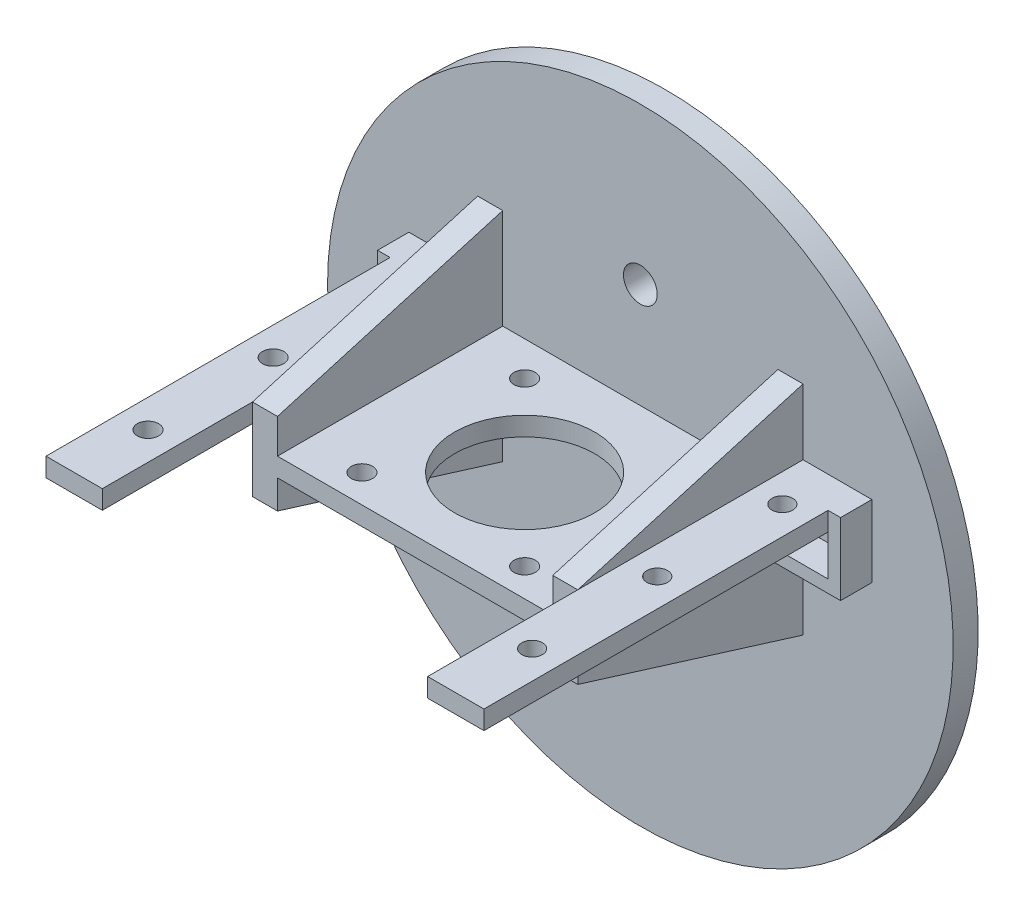
from build123d import *

# Parameters (mm, degrees)
SKETCH_1_W          = 70
SKETCH_1_H          = 58
EXTRUDE_1_DEPTH     = 4
SKETCH_2_W          = 9
SKETCH_2_H          = 3
EXTRUDE_2_DEPTH     = 60
SKETCH_4_W          = 70
SKETCH_4_H          = 4
EXTRUDE_4_DEPTH     = 9.5
EXTRUDE_START       = -9
EXTRUDE_5_DEPTH     = 4
SKETCH_5_R          = 50
EXTRUDE_6_DEPTH     = 4
SKETCH_6_R          = 32.5
EXTRUDE_7_DEPTH     = 6
SKETCH_7_R          = 20
CUT_EXTRUDE_1_DEPTH = 6
SKETCH_8_R          = 2.7
CUT_EXTRUDE_2_DEPTH = 10
SKETCH_9_R          = 2.7
CUT_EXTRUDE_3_DEPTH = 10
SKETCH_11_R         = 11.2
SKETCH_11_R_2       = 1.7
EXTRUDE_8_DEPTH     = 3
SKETCH_13_R         = 1.65
SKETCH_13_R_2       = 1.7
CUT_EXTRUDE_4_DEPTH = 10
EXTRUDE_9_DEPTH     = 5


with BuildPart() as part:
    # 草图1 → 凸台-拉伸1 (new body)
    with BuildSketch(Plane.XY):
        Rectangle(SKETCH_1_W, SKETCH_1_H)
    extrude(amount=EXTRUDE_1_DEPTH)

    # 草图2 → 凸台-拉伸2 (add)
    with BuildSketch(Plane.XY.offset(4)):
        with Locations((-30.5, 17)):
            Rectangle(SKETCH_2_W, SKETCH_2_H)
        with Locations((30.5, 17)):
            Rectangle(SKETCH_2_W, SKETCH_2_H)
    extrude(amount=EXTRUDE_2_DEPTH)

    # 草图4 → 凸台-拉伸4 (add)
    with BuildSketch(Plane(origin=(0, 29, 0), x_dir=(1, 0, 0), z_dir=(0, 1, 0))):
        with Locations((0, -2)):
            Rectangle(SKETCH_4_W, SKETCH_4_H)
    extrude(amount=EXTRUDE_4_DEPTH)

    # 草图3 → 凸台-拉伸5 (add)
    with BuildSketch(Plane(origin=(35, 0, 0), x_dir=(0, 0, -1), z_dir=(1, 0, 0)).offset(EXTRUDE_START)):
        Polygon((-4, 29), (-40, 18.5), (-40, 15.5), (-40, 5.399002441), (-4, -5.764089994), (-4, -29), (0, -29), (0, 29), align=None)
    extrude_5 = extrude(amount=-EXTRUDE_5_DEPTH)

    # 镜向2: 凸台-拉伸5 across plane
    add(extrude_5.mirror(Plane(origin=(0, 0, 0), x_dir=(0, 0, 1), z_dir=(1, 0, 0))))

    # 草图5 → 凸台-拉伸6 (add)
    with BuildSketch(Plane(origin=(0, 0, 0), x_dir=(-1, 0, 0), z_dir=(0, 0, -1))):
        with Locations((0, 4.75)):
            Circle(SKETCH_5_R)
    extrude(amount=-EXTRUDE_6_DEPTH)

    # 草图6 → 凸台-拉伸7 (add)
    with BuildSketch(Plane(origin=(0, 0, 0), x_dir=(-1, 0, 0), z_dir=(0, 0, -1))):
        with Locations((0, 4.75)):
            Circle(SKETCH_6_R)
    extrude(amount=EXTRUDE_7_DEPTH)

    # 草图7 → 切除-拉伸1 (cut)
    with BuildSketch(Plane(origin=(0, 0, -6), x_dir=(-1, 0, 0), z_dir=(0, 0, -1))):
        with Locations((0, 4.75)):
            Circle(SKETCH_7_R)
    extrude(amount=-CUT_EXTRUDE_1_DEPTH, mode=Mode.SUBTRACT)

    # 草图8 → 切除-拉伸2 (cut)
    with BuildSketch(Plane(origin=(0, 0, -6), x_dir=(-1, 0, 0), z_dir=(0, 0, -1))):
        with Locations((0, -20.247950199)):
            Circle(SKETCH_8_R)
        with Locations((0, 29.747950199)):
            Circle(SKETCH_8_R)
    extrude(amount=-CUT_EXTRUDE_2_DEPTH, mode=Mode.SUBTRACT)

    # 草图9 → 切除-拉伸3 (cut)
    with BuildSketch(Plane(origin=(0, 0, 0), x_dir=(-1, 0, 0), z_dir=(0, 0, -1))):
        with Locations((-16, 4.75)):
            Circle(SKETCH_9_R)
        with Locations((16, 4.75)):
            Circle(SKETCH_9_R)
    extrude(amount=-CUT_EXTRUDE_3_DEPTH, mode=Mode.SUBTRACT)

    # 草图11 → 凸台-拉伸8 (add)
    with BuildSketch(Plane(origin=(0, 10, 0), x_dir=(1, 0, 0), z_dir=(0, 1, 0))):
        Polygon((-17.5, -4), (17.5, -4), (22, -4), (22, -40), (17.5, -40), (-17.5, -40), (-22, -40), (-22, -4), align=None)
        with Locations(Location((0, -22.5, 0), (0, 0, 180))):
            Circle(SKETCH_11_R, mode=Mode.SUBTRACT)
        with Locations(Location((-13, -9.5, 0), (0, 0, 180))):
            Circle(SKETCH_11_R_2, mode=Mode.SUBTRACT)
        with Locations(Location((13, -9.5, 0), (0, 0, 180))):
            Circle(SKETCH_11_R_2, mode=Mode.SUBTRACT)
        with Locations(Location((13, -35.5, 0), (0, 0, 180))):
            Circle(SKETCH_11_R_2, mode=Mode.SUBTRACT)
        with Locations(Location((-13, -35.5, 0), (0, 0, 180))):
            Circle(SKETCH_11_R_2, mode=Mode.SUBTRACT)
    extrude(amount=EXTRUDE_8_DEPTH)

    # 草图13 → 切除-拉伸4 (cut)
    with BuildSketch(Plane.XZ.offset(-15.5)):
        with Locations(Location((30.5, 11.8, 0), (0, 0, 270))):
            Circle(SKETCH_13_R)
        with Locations(Location((30.5, 31.8, 0), (0, 0, 270))):
            Circle(SKETCH_13_R)
        with Locations(Location((30.5, 51.8, 0), (0, 0, 270))):
            Circle(SKETCH_13_R)
        with Locations(Location((-30.5, 12.2, 0), (0, 0, 270))):
            Circle(SKETCH_13_R_2)
        with Locations(Location((-30.5, 32.2, 0), (0, 0, 270))):
            Circle(SKETCH_13_R_2)
        with Locations(Location((-30.5, 52.2, 0), (0, 0, 270))):
            Circle(SKETCH_13_R_2)
    extrude(amount=-CUT_EXTRUDE_4_DEPTH, mode=Mode.SUBTRACT)

    # 草图14 → 凸台-拉伸9 (add)
    with BuildSketch(Plane.XY.offset(4)):
        Polygon((26, 9), (35, 9), (35, 15.5), (35, 18.5), (37, 18.5), (37, 7), (26, 7), align=None)
    extrude_9 = extrude(amount=EXTRUDE_9_DEPTH)

    # 镜向3: 凸台-拉伸9 across plane
    add(extrude_9.mirror(Plane(origin=(0, 0, 0), x_dir=(0, 0, 1), z_dir=(1, 0, 0))))


solid = part.part
